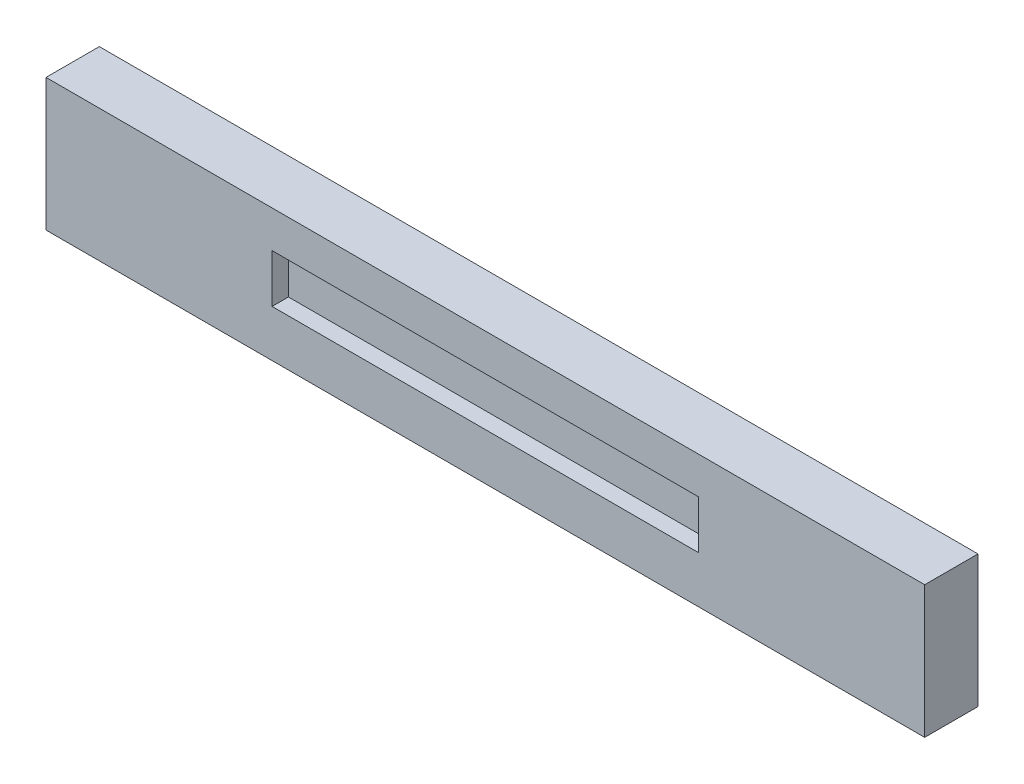
from build123d import *

# Parameters (mm, degrees)
CEK_TAZE_ON_PU_37_5_1_START = 1
SKETCH1_W                   = 618
SKETCH1_H                   = 93
CEK_TAZE_ON_PU_37_5_1_DEPTH = 37.5
CEK_TAZE_ON_PU_37_5_2_START = 27
SKETCH2_W                   = 300
SKETCH2_H                   = 34
CEK_TAZE_ON_PU_37_5_2_DEPTH = 14


with BuildPart() as part:
    # Sketch1 → CEK_taze_on_pu_37.5_1 (new body)
    with BuildSketch(Plane.XY.offset(CEK_TAZE_ON_PU_37_5_1_START)):
        with Locations((309, 46.5)):
            Rectangle(SKETCH1_W, SKETCH1_H)
    extrude(amount=CEK_TAZE_ON_PU_37_5_1_DEPTH)

    # Sketch2 → CEK_taze_on_pu_37.5_2 (cut)
    with BuildSketch(Plane.XY.offset(CEK_TAZE_ON_PU_37_5_2_START)):
        with Locations((309, 50)):
            Rectangle(SKETCH2_W, SKETCH2_H)
    extrude(amount=CEK_TAZE_ON_PU_37_5_2_DEPTH, mode=Mode.SUBTRACT)


solid = part.part
